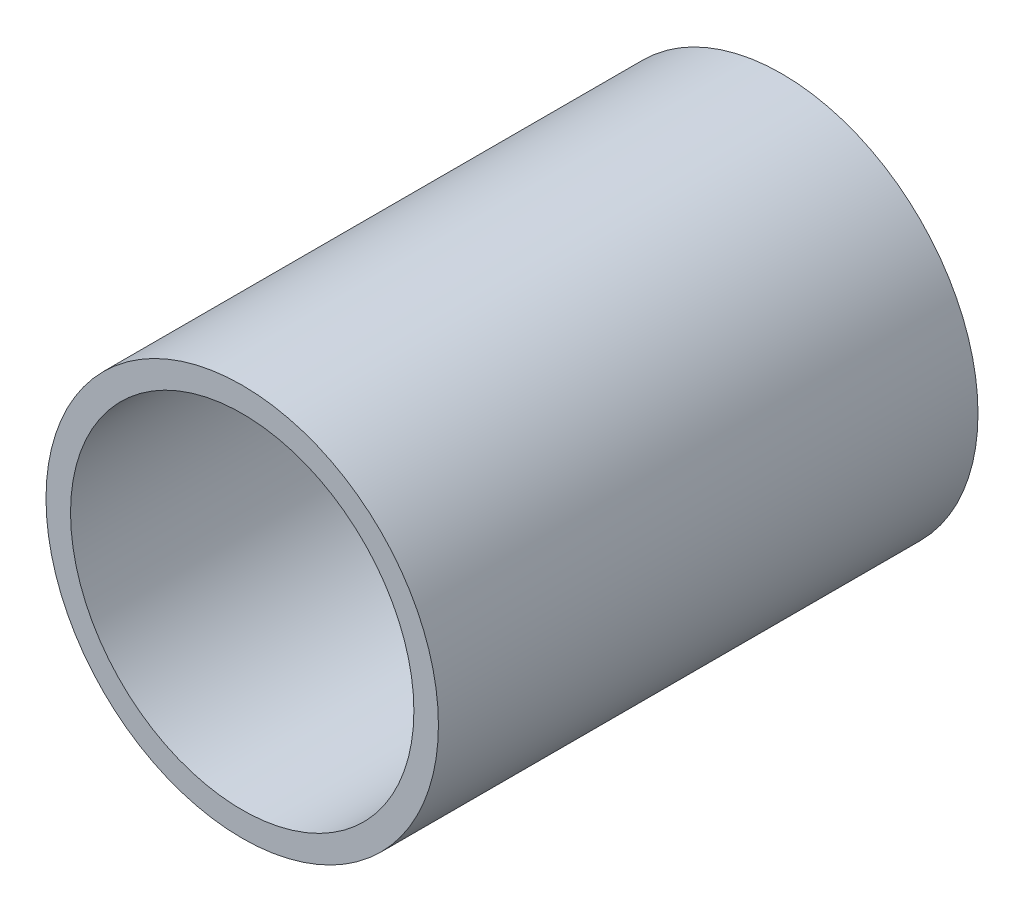
from build123d import *

# Parameters (mm, degrees)
SKETCH1_R           = 40
SKETCH1_R_2         = 35
BOSS_EXTRUDE1_DEPTH = 110


with BuildPart() as part:
    # Sketch1 → Boss-Extrude1 (new body)
    with BuildSketch(Plane.XY):
        Circle(SKETCH1_R)
        Circle(SKETCH1_R_2, mode=Mode.SUBTRACT)
    extrude(amount=BOSS_EXTRUDE1_DEPTH)


solid = part.part
